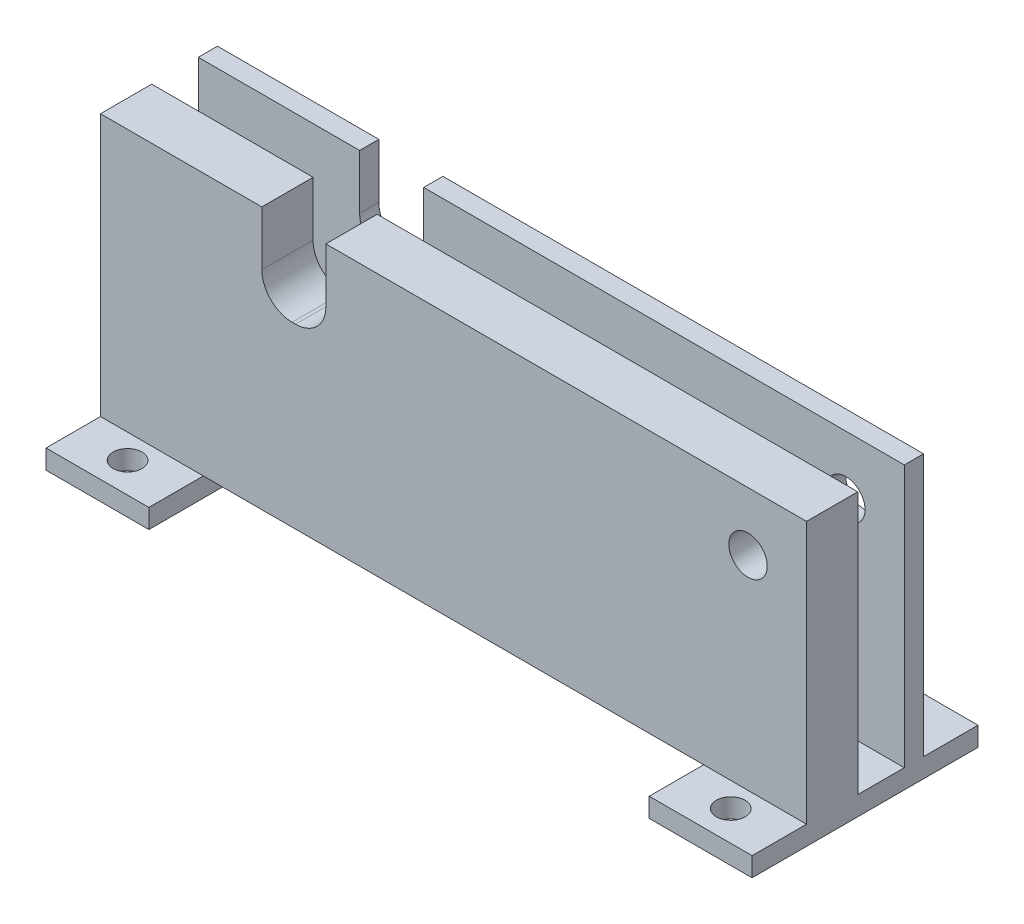
from build123d import *

# Parameters (mm, degrees)
CROQUIS1_W              = 350
CROQUIS1_H              = 130
SALIENTE_EXTRUIR1_DEPTH = 29
CROQUIS2_W              = 51
CROQUIS2_H              = 112
CROQUIS2_R              = 7.14375
SALIENTE_EXTRUIR2_DEPTH = 9.525
CORTAR_EXTRUIR1_DEPTH   = 99.525
CROQUIS4_W              = 23.075
CROQUIS4_H              = 130
CORTAR_EXTRUIR2_DEPTH   = 363.201567673
CROQUIS5_R              = 9.525
CORTAR_EXTRUIR3_DEPTH   = 99.525


with BuildPart() as part:
    # Croquis1 → Saliente-Extruir1 (new, symmetric)
    with BuildSketch(Plane.XY):
        Rectangle(CROQUIS1_W, CROQUIS1_H)
    extrude(amount=SALIENTE_EXTRUIR1_DEPTH, both=True)

    # Croquis2 → Saliente-Extruir2 (add)
    # profile 1 of 2: a face of its own
    with BuildSketch(Plane.XZ.offset(65)):
        with Locations((-149.5, 0)):
            Rectangle(CROQUIS2_W, CROQUIS2_H)
        with Locations(Location((-149.5, 41.05625, 0), (0, 0, 90))):
            Circle(CROQUIS2_R, mode=Mode.SUBTRACT)
        with Locations(Location((-149.5, -41.05625, 0), (0, 0, 90))):
            Circle(CROQUIS2_R, mode=Mode.SUBTRACT)
    # profile 2 of 2: a face of its own
    with BuildSketch(Plane.XZ.offset(65)):
        with Locations((149.5, 0)):
            Rectangle(CROQUIS2_W, CROQUIS2_H)
        with Locations(Location((149.5, -41.05625, 0), (0, 0, 90))):
            Circle(CROQUIS2_R, mode=Mode.SUBTRACT)
        with Locations(Location((149.5, 41.05625, 0), (0, 0, 90))):
            Circle(CROQUIS2_R, mode=Mode.SUBTRACT)
    extrude(amount=SALIENTE_EXTRUIR2_DEPTH)

    # Croquis3 → Cortar-Extruir1 (cut)
    with BuildSketch(Plane(origin=(0, 0, -29), x_dir=(-1, 0, 0), z_dir=(0, 0, -1))):
        with BuildLine():
            Line((95, 65), (63.25, 65))
            Line((63.25, 65), (63.25, 38))
            ThreePointArc((63.25, 38), (67.643398282, 27.393398282), (78.25, 23))
            Line((78.25, 23), (80, 23))
            ThreePointArc((80, 23), (90.606601718, 27.393398282), (95, 38))
            Line((95, 38), (95, 65))
        make_face()
    extrude(amount=-CORTAR_EXTRUIR1_DEPTH, mode=Mode.SUBTRACT)

    # Croquis4 → Cortar-Extruir2 (cut, through all)
    with BuildSketch(Plane(origin=(175, 0, 0), x_dir=(0, 0, -1), z_dir=(1, 0, 0))):
        with Locations((7.9375, 0)):
            Rectangle(CROQUIS4_W, CROQUIS4_H)
    extrude(amount=-CORTAR_EXTRUIR2_DEPTH, mode=Mode.SUBTRACT)

    # Croquis5 → Cortar-Extruir3 (cut)
    with BuildSketch(Plane(origin=(0, 0, -29), x_dir=(-1, 0, 0), z_dir=(0, 0, -1))):
        with Locations((-146, 36)):
            Circle(CROQUIS5_R)
    extrude(amount=-CORTAR_EXTRUIR3_DEPTH, mode=Mode.SUBTRACT)


solid = part.part
